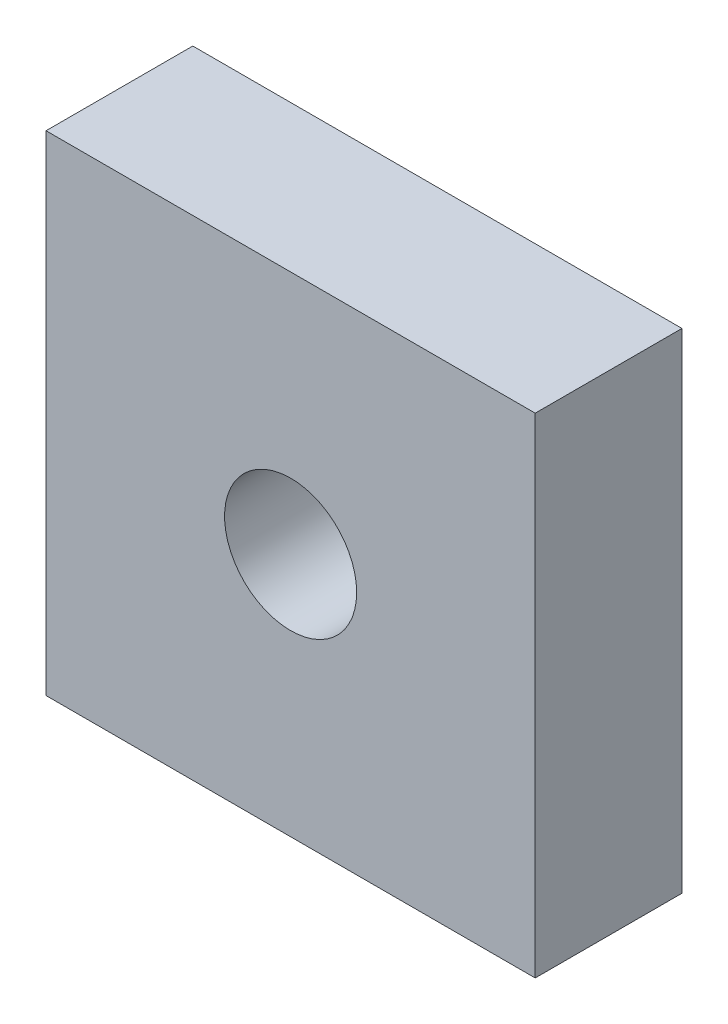
from build123d import *

# Parameters (mm, degrees)
SKETCH1_W           = 20
SKETCH1_H           = 20
SKETCH1_R           = 2.7
BOSS_EXTRUDE1_DEPTH = 6


with BuildPart() as part:
    # Sketch1 → Boss-Extrude1 (new body)
    with BuildSketch(Plane.XY):
        Rectangle(SKETCH1_W, SKETCH1_H)
        Circle(SKETCH1_R, mode=Mode.SUBTRACT)
    extrude(amount=BOSS_EXTRUDE1_DEPTH)


solid = part.part
